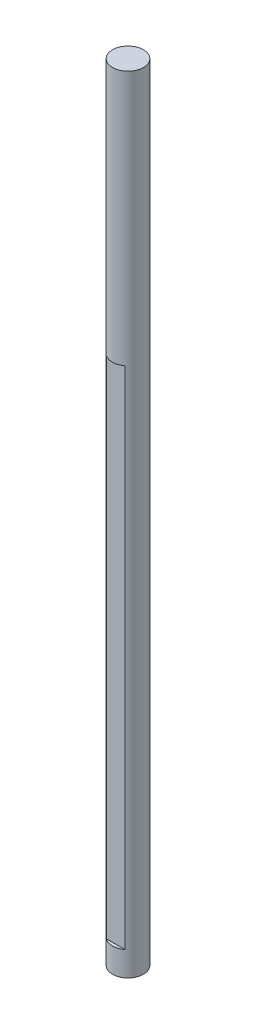
from build123d import *

# Parameters (mm, degrees)
SKETCH1_R           = 4
BOSS_EXTRUDE1_DEPTH = 203.2
SKETCH2_R           = 1.864950538
CUT_EXTRUDE1_DEPTH  = 12.7
CUT_EXTRUDE2_START  = -6.35
CUT_EXTRUDE2_DEPTH  = 130.81


with BuildPart() as part:
    # Sketch1 → Boss-Extrude1 (new body)
    with BuildSketch(Plane(origin=(0, 0, 0), x_dir=(1, 0, 0), z_dir=(0, 1, 0))):
        with Locations(Location((0, 0, 0), (0, 0, 270))):
            Circle(SKETCH1_R)
    extrude(amount=BOSS_EXTRUDE1_DEPTH)

    # Sketch2 → Cut-Extrude1 (cut)
    with BuildSketch(Plane.XZ):
        with Locations(Location((0, 0, 0), (0, 0, 270))):
            Circle(SKETCH2_R)
    extrude(amount=-CUT_EXTRUDE1_DEPTH, mode=Mode.SUBTRACT)

    # Sketch4 → Cut-Extrude2 (cut)
    with BuildSketch(Plane.XZ.offset(CUT_EXTRUDE2_START)):
        Polygon((-31.691808684, 3.184149537), (-2.420989824, 3.184149537), (2.420989824, 3.184149537), (31.691808684, 3.184149537), (31.691808684, 61.725787257), (-31.691808684, 61.725787257), align=None)
    extrude(amount=-CUT_EXTRUDE2_DEPTH, mode=Mode.SUBTRACT)


solid = part.part
